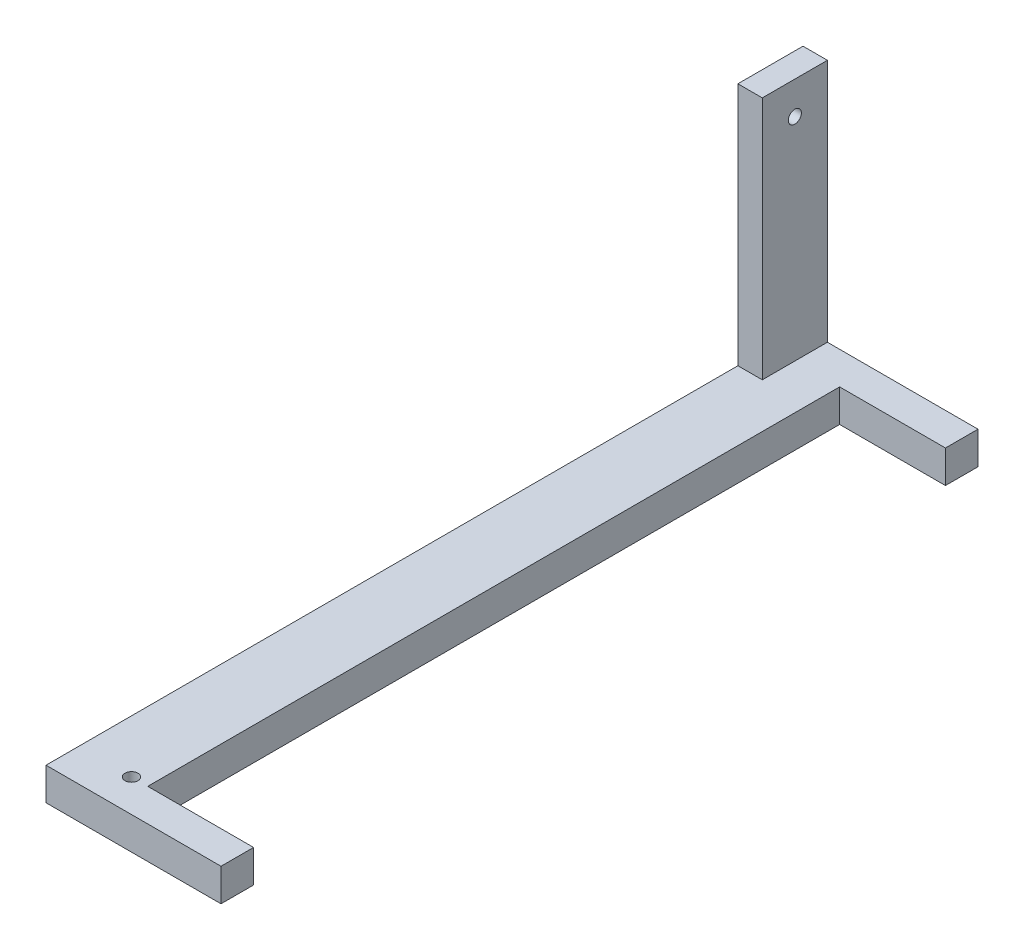
from build123d import *

# Parameters (mm, degrees)
BOSS_EXTRUDE1_DEPTH  = 4
SKETCH2_W            = 8
SKETCH2_H            = 8
BOSS_EXTRUDE2_DEPTH  = 26
BOSS_EXTRUDE3_DEPTH  = 7
BOSS_EXTRUDE4_DEPTH  = 6
M3_CLEARANCE_HOLE1_D = 3.2
M3_CLEARANCE_HOLE2_D = 3.2


with BuildPart() as part:
    # Sketch1 → Boss-Extrude1 (new body)
    with BuildSketch(Plane(origin=(0, 0, 0), x_dir=(0, 0, -1), z_dir=(1, 0, 0))):
        Polygon((0, 0), (-8, 0), (-8, -8), (178, -8), (178, 0), (170, 0), align=None)
    extrude(amount=BOSS_EXTRUDE1_DEPTH)

    # Sketch2 → Boss-Extrude2 (add)
    with BuildSketch(Plane(origin=(4, 0, 0), x_dir=(0, 0, -1), z_dir=(1, 0, 0))):
        with Locations((-4, -4)):
            Rectangle(SKETCH2_W, SKETCH2_H)
        with Locations((174, -4)):
            Rectangle(SKETCH2_W, SKETCH2_H)
    extrude(amount=BOSS_EXTRUDE2_DEPTH)

    # Sketch1<2> → Boss-Extrude3 (add)
    with BuildSketch(Plane(origin=(0, 0, 0), x_dir=(0, 0, -1), z_dir=(1, 0, 0))):
        Polygon((0, 0), (-8, 0), (-8, -8), (178, -8), (178, 0), (170, 0), align=None)
    extrude(amount=-BOSS_EXTRUDE3_DEPTH)

    # Sketch4 → Boss-Extrude4 (add)
    with BuildSketch(Plane.ZY.offset(7)):
        Polygon((-178, 0), (-178, 60), (-162, 60), (-162, 0), (8, 0), (8, -8), (-178, -8), align=None)
    extrude(amount=BOSS_EXTRUDE4_DEPTH)

    # M3 Clearance Hole1 (through all)
    with Locations(Plane.ZX):
        with Locations((0, 0)):
            Hole(M3_CLEARANCE_HOLE1_D / 2)

    # M3 Clearance Hole2 (through all)
    with Locations(Plane(origin=(-7, 52, -170), x_dir=(0, 0, 1), z_dir=(1, 0, 0))):
        with Locations((0, 0)):
            Hole(M3_CLEARANCE_HOLE2_D / 2)


solid = part.part
